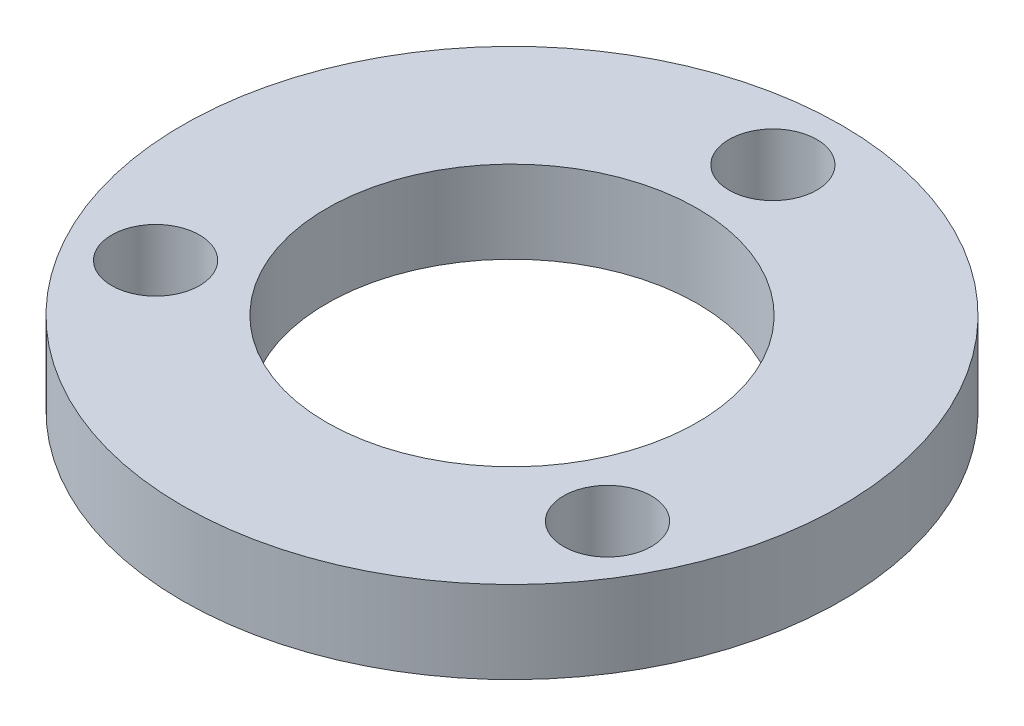
from build123d import *

# Parameters (mm, degrees)
SKETCH_1_R      = 12
SKETCH_1_R_2    = 1.6
SKETCH_1_R_3    = 6.75
EXTRUDE_1_DEPTH = 3


with BuildPart() as part:
    # 草图1 → 凸台-拉伸1 (new body)
    with BuildSketch(Plane(origin=(0, 0, 0), x_dir=(1, 0, 0), z_dir=(0, 1, 0))):
        with Locations(Location((0, 0, 0), (0, 0, 270))):
            Circle(SKETCH_1_R)
        with Locations(Location((0, 9.5, 0), (0, 0, 270))):
            Circle(SKETCH_1_R_2, mode=Mode.SUBTRACT)
        with Locations(Location((8.227241336, -4.75, 0), (0, 0, 270))):
            Circle(SKETCH_1_R_2, mode=Mode.SUBTRACT)
        with Locations(Location((-8.227241336, -4.75, 0), (0, 0, 270))):
            Circle(SKETCH_1_R_2, mode=Mode.SUBTRACT)
        with Locations(Location((0, 0, 0), (0, 0, 270))):
            Circle(SKETCH_1_R_3, mode=Mode.SUBTRACT)
    extrude(amount=EXTRUDE_1_DEPTH)


solid = part.part
